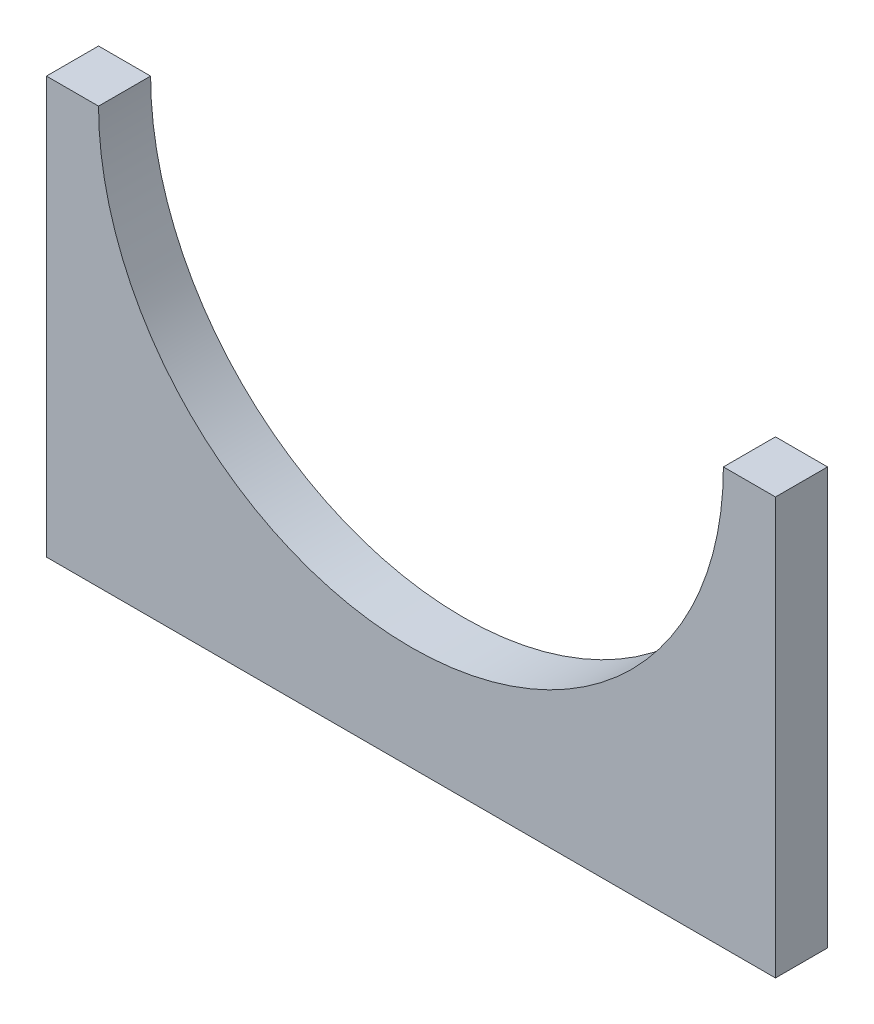
from build123d import *

# Parameters (mm, degrees)
BOSS_EXTRUDE1_DEPTH = 2.5


with BuildPart() as part:
    # Sketch1 → Boss-Extrude1 (new, symmetric)
    with BuildSketch(Plane.XY):
        with BuildLine():
            Line((-35, 0), (-35, -40))
            Line((-35, -40), (35, -40))
            Line((35, -40), (35, 0))
            Line((35, 0), (30, 0))
            ThreePointArc((30, 0), (0, -30), (-30, 0))
            Line((-30, 0), (-35, 0))
        make_face()
    extrude(amount=BOSS_EXTRUDE1_DEPTH, both=True)


solid = part.part
